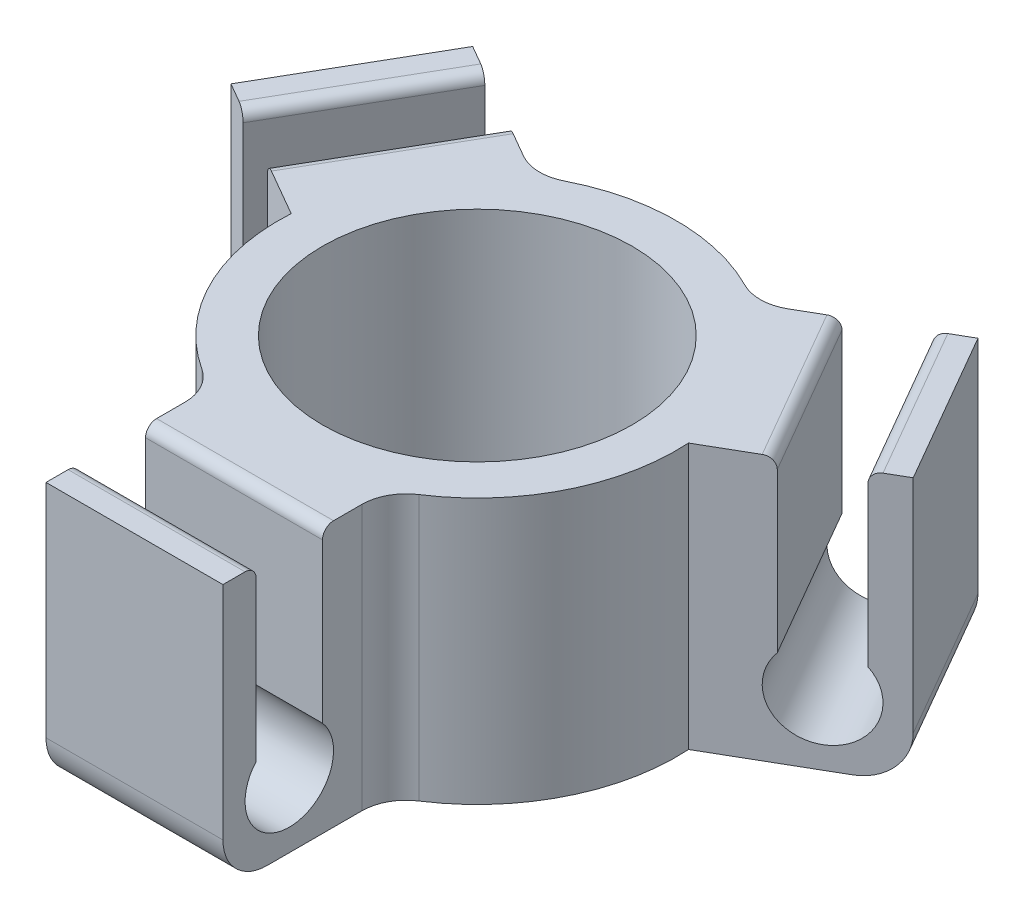
from build123d import *

# Parameters (mm, degrees)
SKETCH1_R           = 9
SKETCH1_R_2         = 7
BOSS_EXTRUDE1_DEPTH = 12
BOSS_EXTRUDE2_START = -0.937742
SKETCH2_W           = 8
SKETCH2_H           = 12
BOSS_EXTRUDE2_DEPTH = 1.437742
BOSS_EXTRUDE3_DEPTH = 8
SKETCH4_R           = 2
CUT_EXTRUDE1_DEPTH  = 11
CIRPATTERN1_COUNT   = 3
FILLET1_R           = 2
FILLET2_R           = 0.5


with BuildPart() as part:
    # Sketch1 → Boss-Extrude1 (new body)
    with BuildSketch(Plane(origin=(0, 0, 0), x_dir=(1, 0, 0), z_dir=(0, 1, 0))):
        with Locations(Location((0, 0, 0), (0, 0, 270))):
            Circle(SKETCH1_R)
        with Locations(Location((0, 0, 0), (0, 0, 270))):
            Circle(SKETCH1_R_2, mode=Mode.SUBTRACT)
    extrude(amount=BOSS_EXTRUDE1_DEPTH)

    # Sketch2 → Boss-Extrude2 (add)
    with BuildSketch(Plane.XY.offset(9).offset(BOSS_EXTRUDE2_START)):
        with Locations((0, 6)):
            Rectangle(SKETCH2_W, SKETCH2_H)
    boss_extrude2 = extrude(amount=BOSS_EXTRUDE2_DEPTH)

    # Sketch3 → Boss-Extrude3 (add)
    with BuildSketch(Plane.ZY.offset(4)):
        Polygon((9.5, 0), (12.5, 0), (15.5, 0), (15.5, 12), (14, 12), (14, 3), (11, 3), (11, 12), (9.5, 12), align=None)
    boss_extrude3 = extrude(amount=-BOSS_EXTRUDE3_DEPTH)

    # Sketch4 → Cut-Extrude1 (cut)
    with BuildSketch(Plane.ZY.offset(4)):
        with Locations((12.5, 3)):
            Circle(SKETCH4_R)
    cut_extrude1 = extrude(amount=-CUT_EXTRUDE1_DEPTH, mode=Mode.SUBTRACT)

    # CirPattern1: Boss-Extrude2, Boss-Extrude3, Cut-Extrude1 ×3 about axis
    cirpattern1_axis = Axis((0, 0, 0), (0, 1, 0))
    add([boss_extrude2.rotate(cirpattern1_axis, i * 360 / CIRPATTERN1_COUNT) for i in range(1, CIRPATTERN1_COUNT)])
    add([boss_extrude3.rotate(cirpattern1_axis, i * 360 / CIRPATTERN1_COUNT) for i in range(1, CIRPATTERN1_COUNT)])
    add([cut_extrude1.rotate(cirpattern1_axis, i * 360 / CIRPATTERN1_COUNT) for i in range(1, CIRPATTERN1_COUNT)], mode=Mode.SUBTRACT)

    # Fillet1
    fillet1_edges = [part.edges().sort_by_distance(p)[0] for p in [
        (-13.423393759, 0, -7.75),
        (4, 6, 8.062258),
        (-4, 6, 8.062258),
        (0, 0, 15.5),
        (4.98212024, 6, -7.495230615),
        (-4.98212024, 6, -7.495230615),
        (13.423393759, 0, -7.75),
    ]]
    fillet(fillet1_edges, radius=FILLET1_R)

    # Fillet2
    fillet2_edges = [part.edges().sort_by_distance(p)[0] for p in [
        (-12.124355653, 12, -7),
        (0, 12, 11),
        (0, 12, 14),
        (9.526279442, 12, -5.5),
        (12.124355653, 12, -7),
        (-9.526279442, 12, -5.5),
    ]]
    fillet(fillet2_edges, radius=FILLET2_R)


solid = part.part
